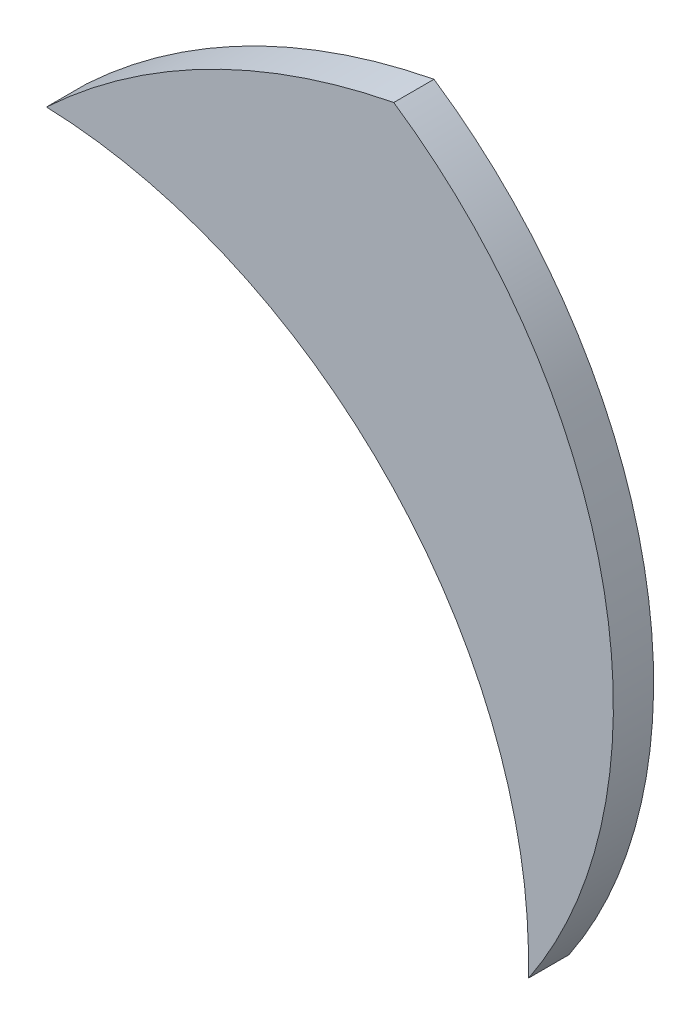
from build123d import *

# Parameters (mm, degrees)
BOSS_EXTRUDE1_DEPTH = 50.8


with BuildPart() as part:
    # Sketch1 → Boss-Extrude1 (new body)
    with BuildSketch(Plane.XY):
        with BuildLine():
            Line((0.035126394, 1.11988868), (0.634791513, 0.943099294))
            ThreePointArc((0.634791513, 0.943099294), (95.778449388, 472.029344824), (-169.690953016, 872.654559642))
            ThreePointArc((-169.690953016, 872.654559642), (-404.678587099, 791.55305643), (-608.023663576, 648.558574481))
            ThreePointArc((-608.023663576, 648.558574481), (-170.074292437, 450.61364148), (0.035126394, 1.11988868))
        make_face()
    extrude(amount=BOSS_EXTRUDE1_DEPTH)


solid = part.part
